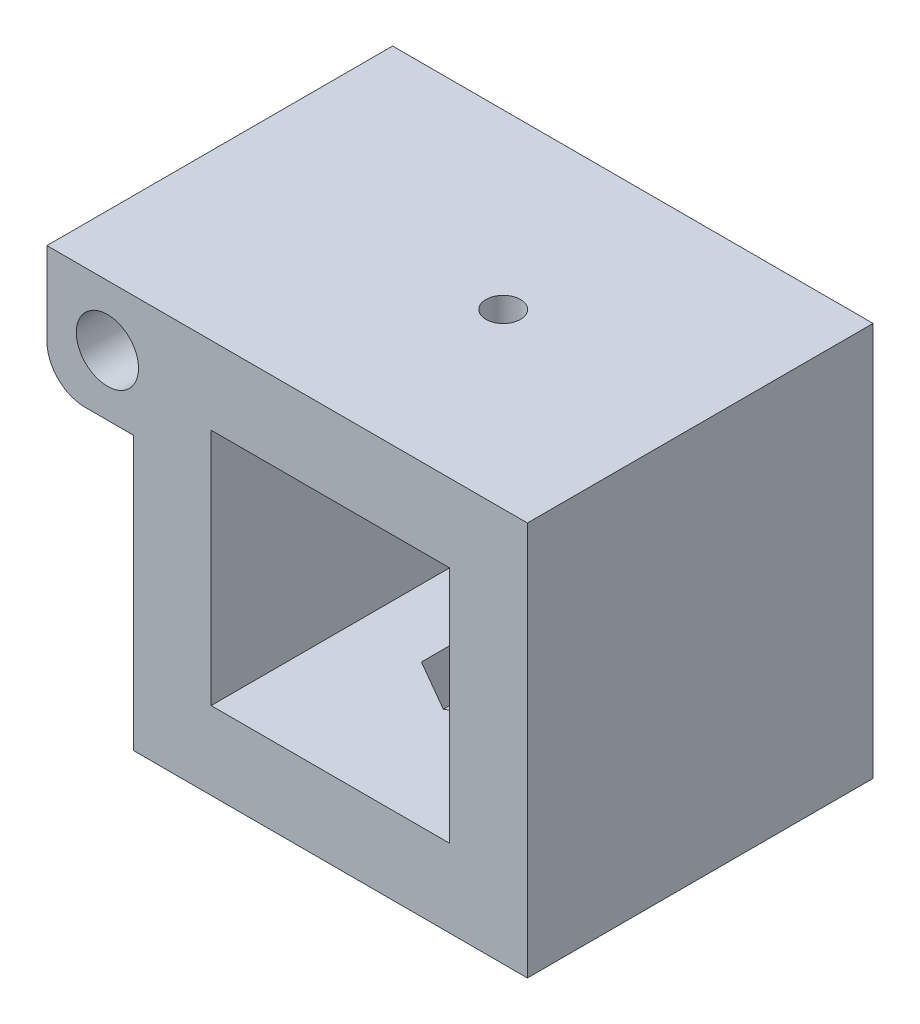
from build123d import *

# Parameters (mm, degrees)
CROQUIS1_W                                           = 22.8
CROQUIS1_H                                           = 22.8
CROQUIS1_W_2                                         = 13.8
CROQUIS1_H_2                                         = 13.8
SALIENTE_EXTRUIR1_DEPTH                              = 10
CORTAR_EXTRUIR1_DEPTH                                = 3
CROQUIS3_R                                           = 1.75
CORTAR_EXTRUIR2_DEPTH                                = 3
SALIENTE_EXTRUIR3_DEPTH                              = 20
REFRENTADO_PARA_TORNILLO_CON_CABEZA_PLAN_D           = 3.6
REFRENTADO_PARA_TORNILLO_CON_CABEZA_PLAN_CBORE_D     = 6.5
REFRENTADO_PARA_TORNILLO_CON_CABEZA_PLAN_CBORE_DEPTH = 2
REDONDEO1_R                                          = 2.2
CROQUIS12_R                                          = 1
CORTAR_EXTRUIR5_DEPTH                                = 10


with BuildPart() as part:
    # Croquis1 → Saliente-Extruir1 (new, symmetric)
    with BuildSketch(Plane.XY):
        Rectangle(CROQUIS1_W, CROQUIS1_H)
        Rectangle(CROQUIS1_W_2, CROQUIS1_H_2, mode=Mode.SUBTRACT)
    extrude(amount=SALIENTE_EXTRUIR1_DEPTH, both=True)

    # Croquis2 → Cortar-Extruir1 (cut)
    with BuildSketch(Plane(origin=(0, -6.9, 0), x_dir=(1, 0, 0), z_dir=(0, 1, 0))):
        Polygon((3, -1.732050808), (3, 1.732050808), (0, 3.464101615), (-3, 1.732050808), (-3, -1.732050808), (0, -3.464101615), align=None)
    extrude(amount=-CORTAR_EXTRUIR1_DEPTH, mode=Mode.SUBTRACT)

    # Croquis3 → Cortar-Extruir2 (cut)
    with BuildSketch(Plane(origin=(0, -9.9, 0), x_dir=(1, 0, 0), z_dir=(0, 1, 0))):
        with Locations(Location((0, 0, 0), (0, 0, 270))):
            Circle(CROQUIS3_R)
    extrude(amount=-CORTAR_EXTRUIR2_DEPTH, mode=Mode.SUBTRACT)

    # Croquis4 → Saliente-Extruir3 (add)
    with BuildSketch(Plane(origin=(0, 0, 10), x_dir=(-1, 0, 0), z_dir=(0, 0, -1))):
        with BuildLine():
            Line((16.4, 11.4), (12.9, 11.4))
            Line((12.9, 11.4), (12.9, 9.5))
            ThreePointArc((12.9, 9.5), (14.03137085, 9.03137085), (14.5, 7.9))
            ThreePointArc((14.5, 7.9), (14.03137085, 6.76862915), (12.9, 6.3))
            Line((12.9, 6.3), (12.9, 4.4))
            Line((12.9, 4.4), (16.4, 4.4))
            Line((16.4, 4.4), (16.4, 11.4))
        make_face()
        with BuildLine():
            Line((12.9, 4.4), (12.9, 6.3))
            ThreePointArc((12.9, 6.3), (11.986447127, 6.586447127), (11.4, 7.343223564))
            Line((11.4, 7.343223564), (11.4, 4.4))
            Line((11.4, 4.4), (12.9, 4.4))
        make_face()
        with BuildLine():
            Line((12.9, 9.5), (12.9, 11.4))
            Line((12.9, 11.4), (11.4, 11.4))
            Line((11.4, 11.4), (11.4, 8.456776436))
            ThreePointArc((11.4, 8.456776436), (11.986447127, 9.213552873), (12.9, 9.5))
        make_face()
    extrude(amount=SALIENTE_EXTRUIR3_DEPTH)

    # Refrentado para tornillo con cabeza plana de M32 (through all)
    with Locations(Plane(origin=(-12.9, 7.9, -10), x_dir=(-1, 0, 0), z_dir=(0, 0, -1))):
        with Locations((0, 0)):
            CounterBoreHole(REFRENTADO_PARA_TORNILLO_CON_CABEZA_PLAN_D / 2, REFRENTADO_PARA_TORNILLO_CON_CABEZA_PLAN_CBORE_D / 2, REFRENTADO_PARA_TORNILLO_CON_CABEZA_PLAN_CBORE_DEPTH)

    # Redondeo1
    redondeo1_edges = [part.edges().sort_by_distance(p)[0] for p in [
        (-16.4, 4.4, 0),
    ]]
    fillet(redondeo1_edges, radius=REDONDEO1_R)

    # Croquis12 → Cortar-Extruir5 (cut)
    with BuildSketch(Plane(origin=(0, 11.4, 0), x_dir=(1, 0, 0), z_dir=(0, 1, 0))):
        with Locations(Location((0, 0, 0), (0, 0, 270))):
            Circle(CROQUIS12_R)
    extrude(amount=-CORTAR_EXTRUIR5_DEPTH, mode=Mode.SUBTRACT)


solid = part.part
